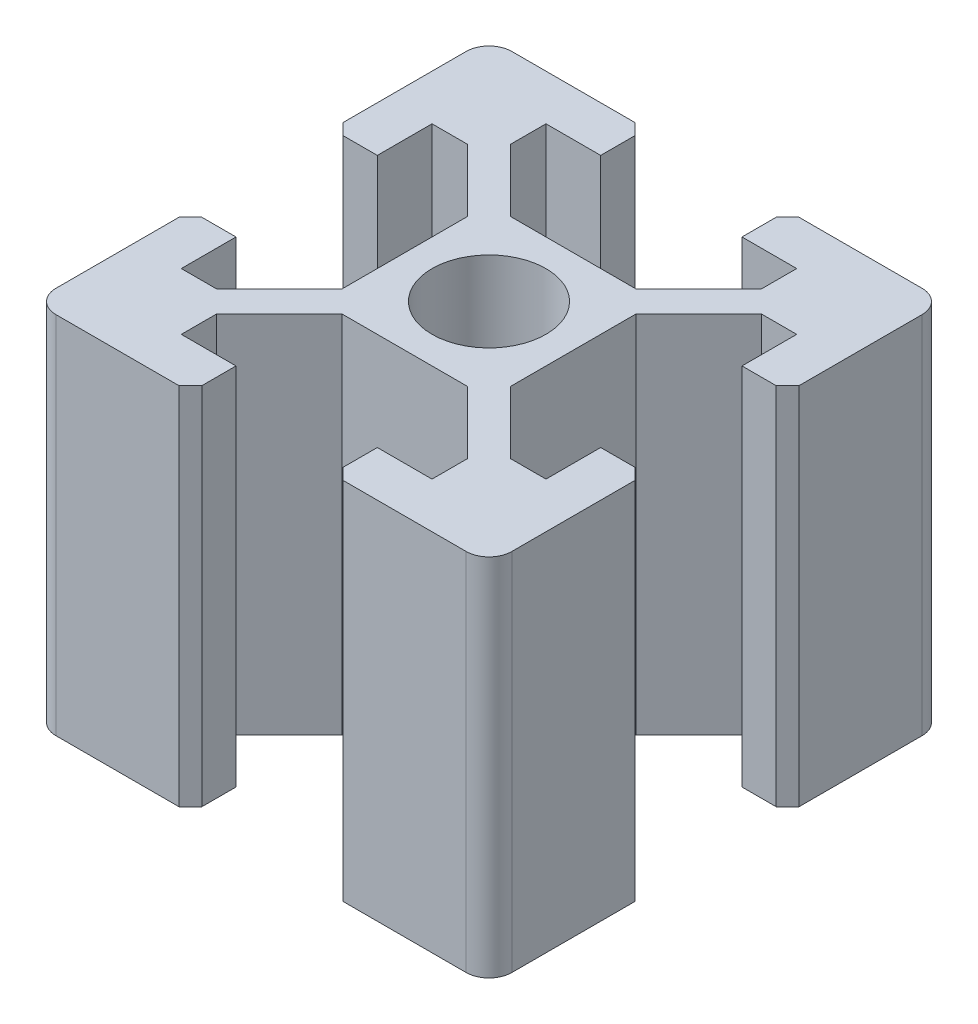
from build123d import *

# Parameters (mm, degrees)
SKETCH1_R           = 2.5
BOSS_EXTRUDE1_DEPTH = 16


with BuildPart() as part:
    # Sketch1 → Boss-Extrude1 (new body)
    with BuildSketch(Plane(origin=(0, 0, 0), x_dir=(1, 0, 0), z_dir=(0, 1, 0))):
        with BuildLine():
            Line((3.6, 10), (9, 10))
            ThreePointArc((9, 10), (9.707106781, 9.707106781), (10, 9))
            Line((10, 9), (10, 3.6))
            Line((10, 3.6), (9.5, 3.1))
            Line((9.5, 3.1), (8, 3.1))
            Line((8, 3.1), (8, 5.5))
            Line((8, 5.5), (6.45, 5.5))
            Line((6.45, 5.5), (3.7, 2.75))
            Line((3.7, 2.75), (3.7, -2.75))
            Line((3.7, -2.75), (6.45, -5.5))
            Line((6.45, -5.5), (8, -5.5))
            Line((8, -5.5), (8, -3.1))
            Line((8, -3.1), (9.5, -3.1))
            Line((9.5, -3.1), (10, -3.6))
            Line((10, -3.6), (10, -9))
            ThreePointArc((10, -9), (9.707106781, -9.707106781), (9, -10))
            Line((9, -10), (3.6, -10))
            Line((3.6, -10), (3.1, -9.5))
            Line((3.1, -9.5), (3.1, -8))
            Line((3.1, -8), (5.5, -8))
            Line((5.5, -8), (5.5, -6.45))
            Line((5.5, -6.45), (2.75, -3.7))
            Line((2.75, -3.7), (-2.75, -3.7))
            Line((-2.75, -3.7), (-5.5, -6.45))
            Line((-5.5, -6.45), (-5.5, -8))
            Line((-5.5, -8), (-3.1, -8))
            Line((-3.1, -8), (-3.1, -9.5))
            Line((-3.1, -9.5), (-3.6, -10))
            Line((-3.6, -10), (-9, -10))
            ThreePointArc((-9, -10), (-9.707106781, -9.707106781), (-10, -9))
            Line((-10, -9), (-10, -3.6))
            Line((-10, -3.6), (-9.5, -3.1))
            Line((-9.5, -3.1), (-8, -3.1))
            Line((-8, -3.1), (-8, -5.5))
            Line((-8, -5.5), (-6.45, -5.5))
            Line((-6.45, -5.5), (-3.7, -2.75))
            Line((-3.7, -2.75), (-3.7, 2.75))
            Line((-3.7, 2.75), (-6.45, 5.5))
            Line((-6.45, 5.5), (-8, 5.5))
            Line((-8, 5.5), (-8, 3.1))
            Line((-8, 3.1), (-9.5, 3.1))
            Line((-9.5, 3.1), (-10, 3.6))
            Line((-10, 3.6), (-10, 9))
            ThreePointArc((-10, 9), (-9.707106781, 9.707106781), (-9, 10))
            Line((-9, 10), (-3.6, 10))
            Line((-3.6, 10), (-3.1, 9.5))
            Line((-3.1, 9.5), (-3.1, 8))
            Line((-3.1, 8), (-5.5, 8))
            Line((-5.5, 8), (-5.5, 6.45))
            Line((-5.5, 6.45), (-2.75, 3.7))
            Line((-2.75, 3.7), (2.75, 3.7))
            Line((2.75, 3.7), (5.5, 6.45))
            Line((5.5, 6.45), (5.5, 8))
            Line((5.5, 8), (3.1, 8))
            Line((3.1, 8), (3.1, 9.5))
            Line((3.1, 9.5), (3.6, 10))
        make_face()
        with Locations(Location((0, 0, 0), (0, 0, 270))):
            Circle(SKETCH1_R, mode=Mode.SUBTRACT)
    extrude(amount=BOSS_EXTRUDE1_DEPTH)


solid = part.part
